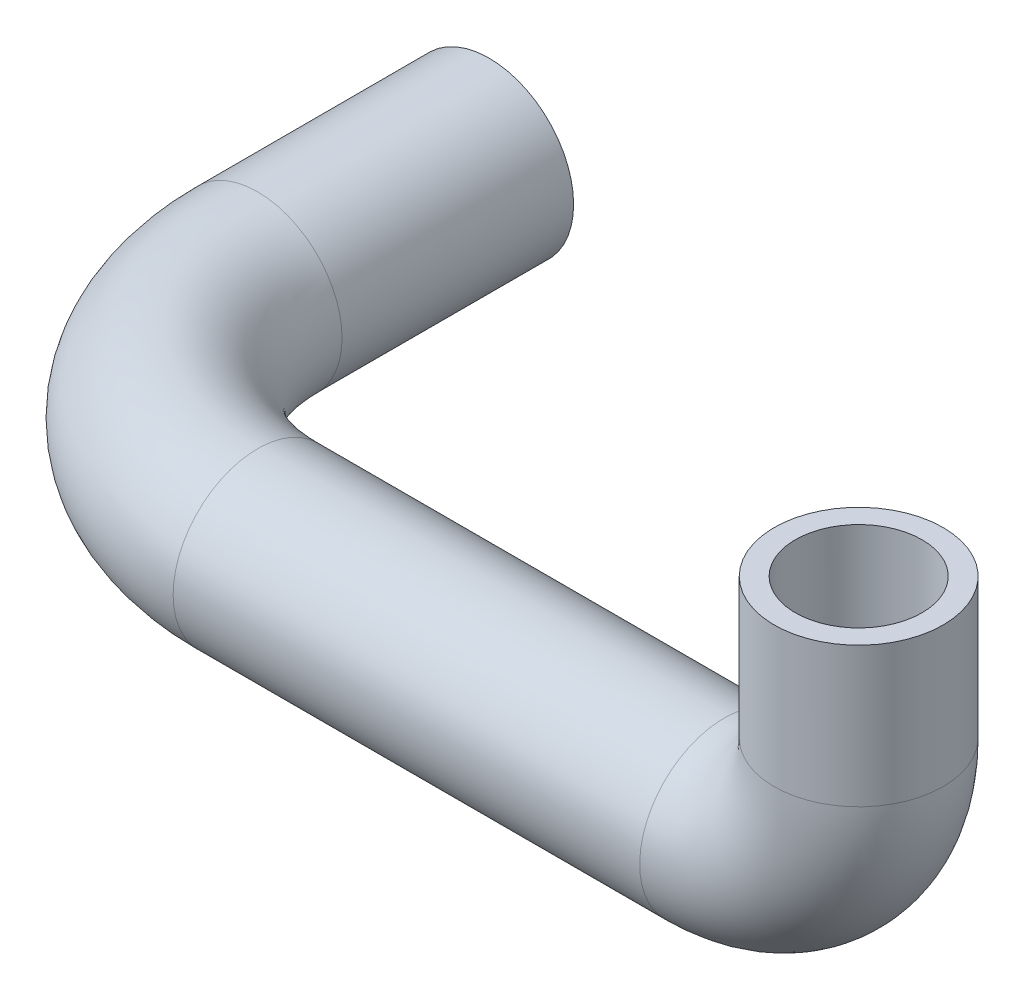
from build123d import *

# Parameters (mm, degrees)
SWEEP1_PROFILE_R                           = 8
HOLLOW_TUBE_OD_AND_WALL_PROVISIONAL_PROF_R = 6


with BuildPart() as part:
    # Sweep1: sweep along a curve in space
    with BuildLine() as sweep1_path:
        Line((0, 0, 0), (0, 0, 21.930000411))
        ThreePointArc((0, 0, 21.930000411), (6.171260145, 0, 36.828740145), (21.07, 0, 43))
        Line((21.07, 0, 43), (65.259998661, 0, 43))
        ThreePointArc((65.259998661, 0, 43), (74.268539526, 3.731459526, 43), (78, 12.74, 43))
        Line((78, 12.74, 43), (78, 26, 43))
    # Sweep1 profile (on start of the path) → Sweep1 (sweep)
    with BuildSketch(Plane.XY):
        Circle(SWEEP1_PROFILE_R)
    sweep(path=sweep1_path.line)

    # Hollow_tube_OD_and_wall_PROVISIONAL: sweep along a curve in space
    with BuildLine() as hollow_tube_od_and_wall_provisional_path:
        Line((0, 0, 0), (0, 0, 21.930000411))
        ThreePointArc((0, 0, 21.930000411), (6.171260145, 0, 36.828740145), (21.07, 0, 43))
        Line((21.07, 0, 43), (65.259998661, 0, 43))
        ThreePointArc((65.259998661, 0, 43), (74.268539526, 3.731459526, 43), (78, 12.74, 43))
        Line((78, 12.74, 43), (78, 26, 43))
    # Hollow_tube_OD_and_wall_PROVISIONAL prof (on start of the path) → Hollow_tube_OD_and_wall_PROVISIONAL (sweep, cut)
    with BuildSketch(Plane.XY):
        Circle(HOLLOW_TUBE_OD_AND_WALL_PROVISIONAL_PROF_R)
    sweep(path=hollow_tube_od_and_wall_provisional_path.line, mode=Mode.SUBTRACT)


solid = part.part
